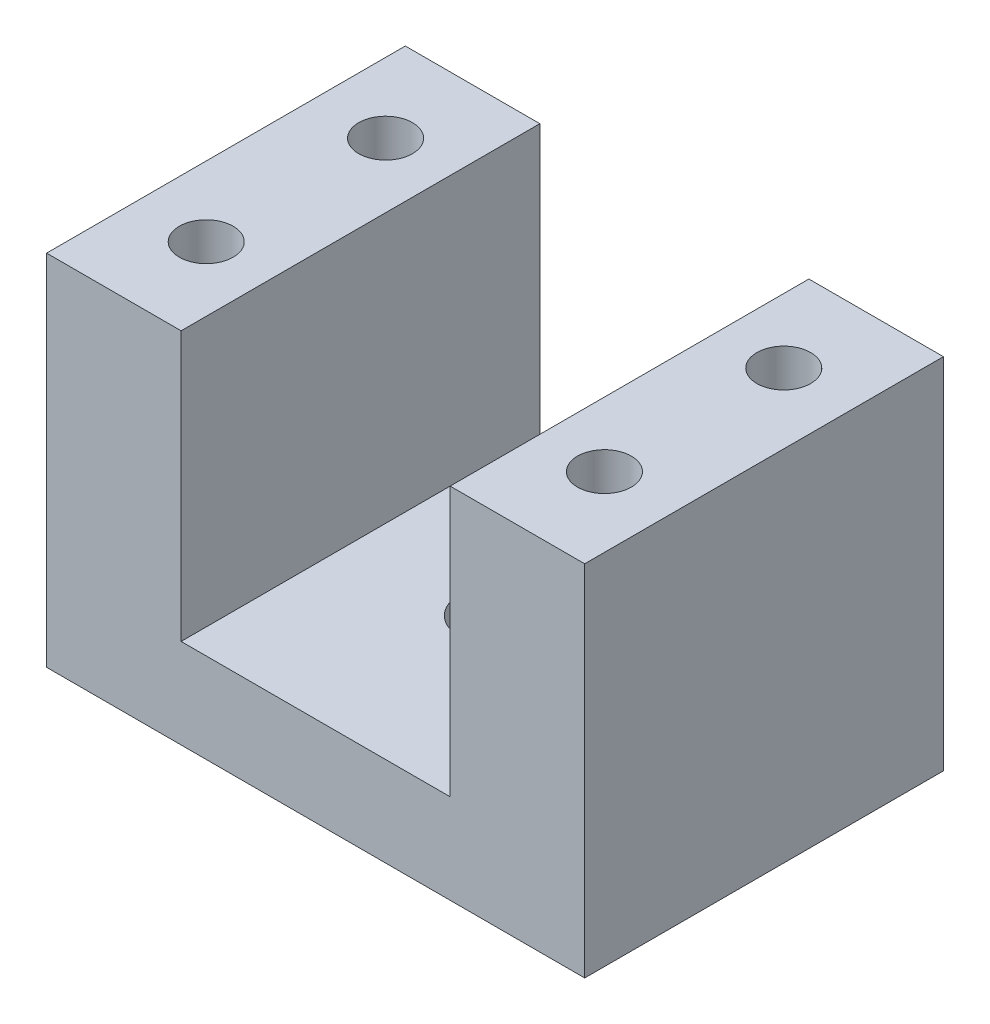
from build123d import *

# Parameters (mm, degrees)
EXTRUDE_1_DEPTH     = 10
SKETCH_2_R          = 1.5
CUT_EXTRUDE_1_DEPTH = 10
CUT_EXTRUDE_2_REACH = 25.452
SKETCH_3_R          = 2


with BuildPart() as part:
    # 草图1 → 凸台-拉伸1 (new, symmetric)
    with BuildSketch(Plane.XY):
        Polygon((7.5, 0), (-7.5, 0), (-7.5, 15), (-15, 15), (-15, -5), (15, -5), (15, 15), (7.5, 15), align=None)
    extrude(amount=EXTRUDE_1_DEPTH, both=True)

    # 草图2 → 切除-拉伸1 (cut)
    with BuildSketch(Plane(origin=(0, 15, 0), x_dir=(1, 0, 0), z_dir=(0, 1, 0))):
        with Locations(Location((-11.1, 5, 0), (0, 0, 180))):
            Circle(SKETCH_2_R)
        with Locations(Location((11.1, -5, 0), (0, 0, 180))):
            Circle(SKETCH_2_R)
        with Locations((11.1, 5)):
            Circle(SKETCH_2_R)
        with Locations((-11.1, -5)):
            Circle(SKETCH_2_R)
    extrude(amount=-CUT_EXTRUDE_1_DEPTH, mode=Mode.SUBTRACT)

    # 草图3 → 切除-拉伸2 (cut, up to next)
    with BuildSketch(Plane(origin=(0, 0, 0), x_dir=(1, 0, 0), z_dir=(0, 1, 0)), mode=Mode.PRIVATE) as cut_extrude_2_sk1:
        with Locations(Location((0, 0, 0), (0, 0, 180))):
            Circle(SKETCH_3_R)
    cut_extrude_2_tool1 = extrude(cut_extrude_2_sk1.sketch, amount=-CUT_EXTRUDE_2_REACH, mode=Mode.PRIVATE) & part.part
    add(cut_extrude_2_tool1.solids().sort_by_distance((0, 0, 0))[0], mode=Mode.SUBTRACT)


solid = part.part
